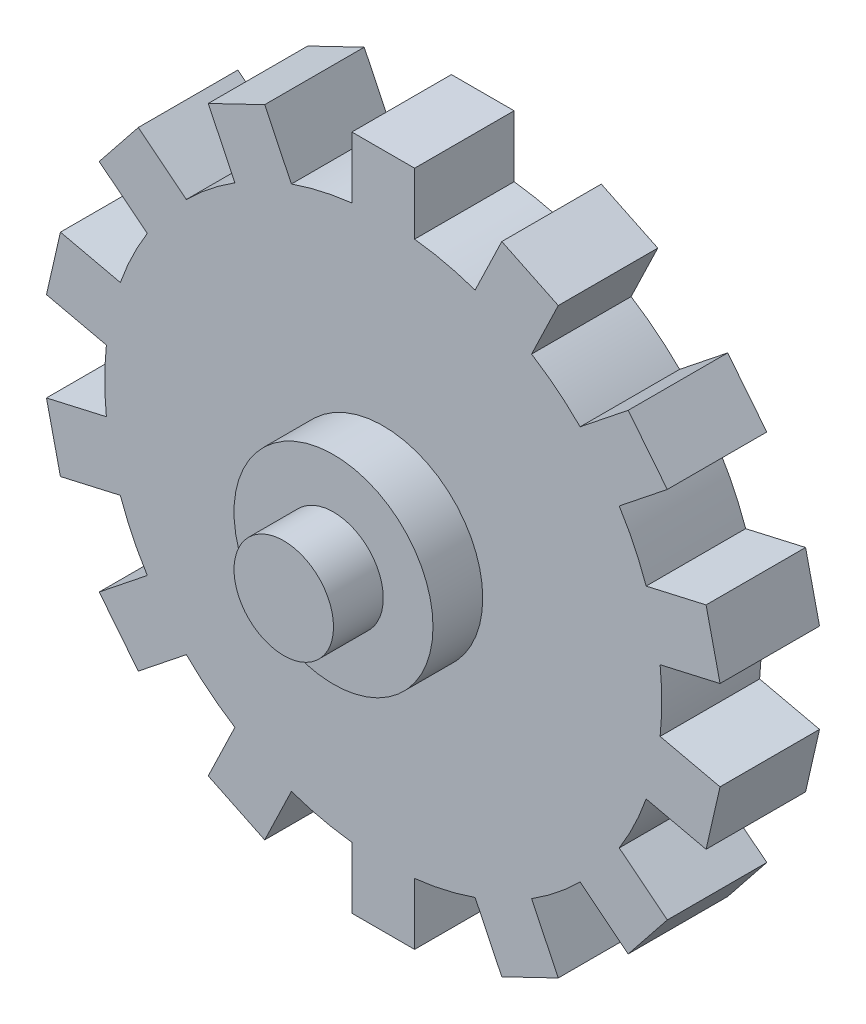
from build123d import *

# Parameters (mm, degrees)
SKETCH2_R           = 28
BOSS_EXTRUDE1_DEPTH = 5
SKETCH5_W           = 6.3
SKETCH5_H           = 12
BOSS_EXTRUDE2_DEPTH = 10
CIRPATTERN1_COUNT   = 14
SKETCH6_R           = 10
BOSS_EXTRUDE3_DEPTH = 5
SKETCH7_R           = 5
BOSS_EXTRUDE4_DEPTH = 5


with BuildPart() as part:
    # Sketch2 → Boss-Extrude1 (new, symmetric)
    with BuildSketch(Plane.XY):
        Circle(SKETCH2_R)
    extrude(amount=BOSS_EXTRUDE1_DEPTH, both=True)

    # Sketch5 → Boss-Extrude2 (add)
    with BuildSketch(Plane.XY.offset(5)):
        with Locations((0, 28)):
            Rectangle(SKETCH5_W, SKETCH5_H)
    boss_extrude2 = extrude(amount=-BOSS_EXTRUDE2_DEPTH)

    # CirPattern1: Boss-Extrude2 ×14 about axis
    cirpattern1_axis = Axis((0, 0, 0), (0, 0, 1))
    for i in range(1, CIRPATTERN1_COUNT):
        add(boss_extrude2.rotate(cirpattern1_axis, i * 360 / CIRPATTERN1_COUNT))

    # Sketch6 → Boss-Extrude3 (add)
    with BuildSketch(Plane.XY.offset(5)):
        Circle(SKETCH6_R)
    boss_extrude3 = extrude(amount=BOSS_EXTRUDE3_DEPTH)

    # Sketch7 → Boss-Extrude4 (add)
    with BuildSketch(Plane.XY.offset(10)):
        Circle(SKETCH7_R)
    boss_extrude4 = extrude(amount=BOSS_EXTRUDE4_DEPTH)

    # Mirror1: Boss-Extrude3, Boss-Extrude4 across plane
    add(boss_extrude3.mirror(Plane.XY))
    add(boss_extrude4.mirror(Plane.XY))


solid = part.part
